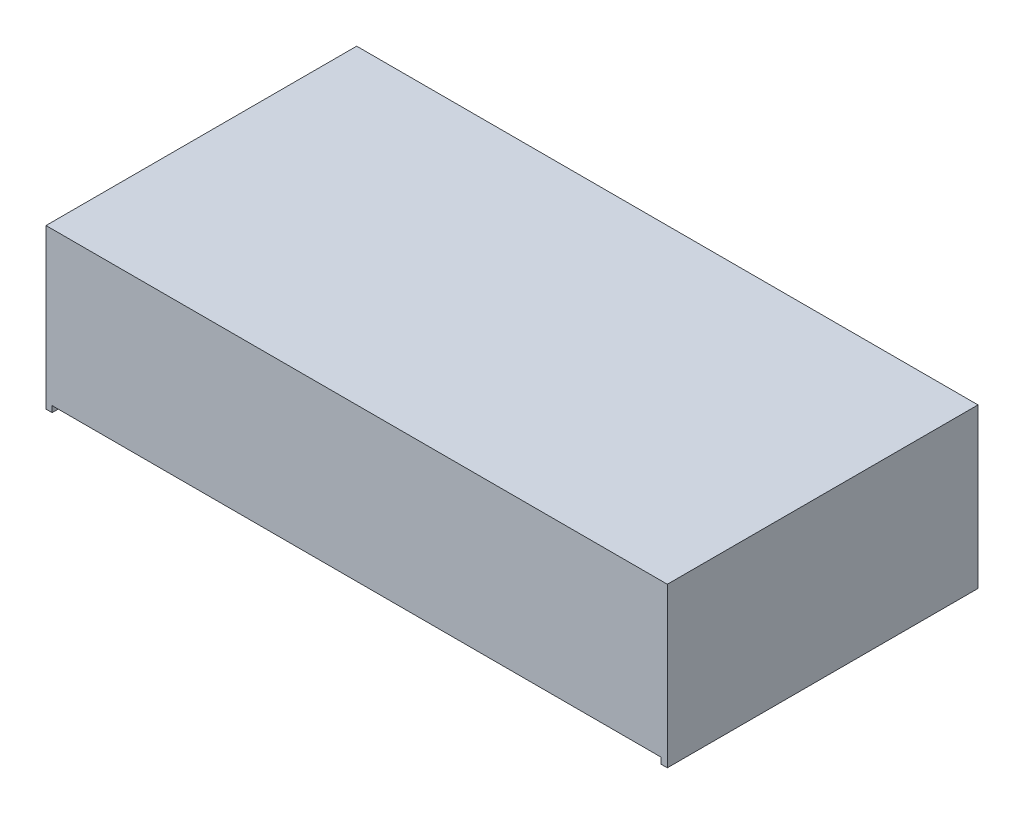
from build123d import *

# Parameters (mm, degrees)
SKETCH1_W           = 50.8
SKETCH1_H           = 25.4
BOSS_EXTRUDE1_DEPTH = 13
CUT_EXTRUDE1_REACH  = 40.201
SKETCH2_W           = 49.8
SKETCH2_H           = 2.525610112


with BuildPart() as part:
    # Sketch1 → Boss-Extrude1 (new body)
    with BuildSketch(Plane(origin=(0, 0, 0), x_dir=(1, 0, 0), z_dir=(0, 1, 0))):
        Rectangle(SKETCH1_W, SKETCH1_H)
    extrude(amount=BOSS_EXTRUDE1_DEPTH)

    # Sketch2 → Cut-Extrude1 (cut, up to next)
    with BuildSketch(Plane.XY.offset(12.7), mode=Mode.PRIVATE) as cut_extrude1_sk1:
        with Locations((0, -0.762805056)):
            Rectangle(SKETCH2_W, SKETCH2_H)
    cut_extrude1_tool1 = extrude(cut_extrude1_sk1.sketch, amount=-CUT_EXTRUDE1_REACH, mode=Mode.PRIVATE) & part.part
    add(cut_extrude1_tool1.solids().sort_by_distance((0, -0.762805, 12.7))[0], mode=Mode.SUBTRACT)


solid = part.part
